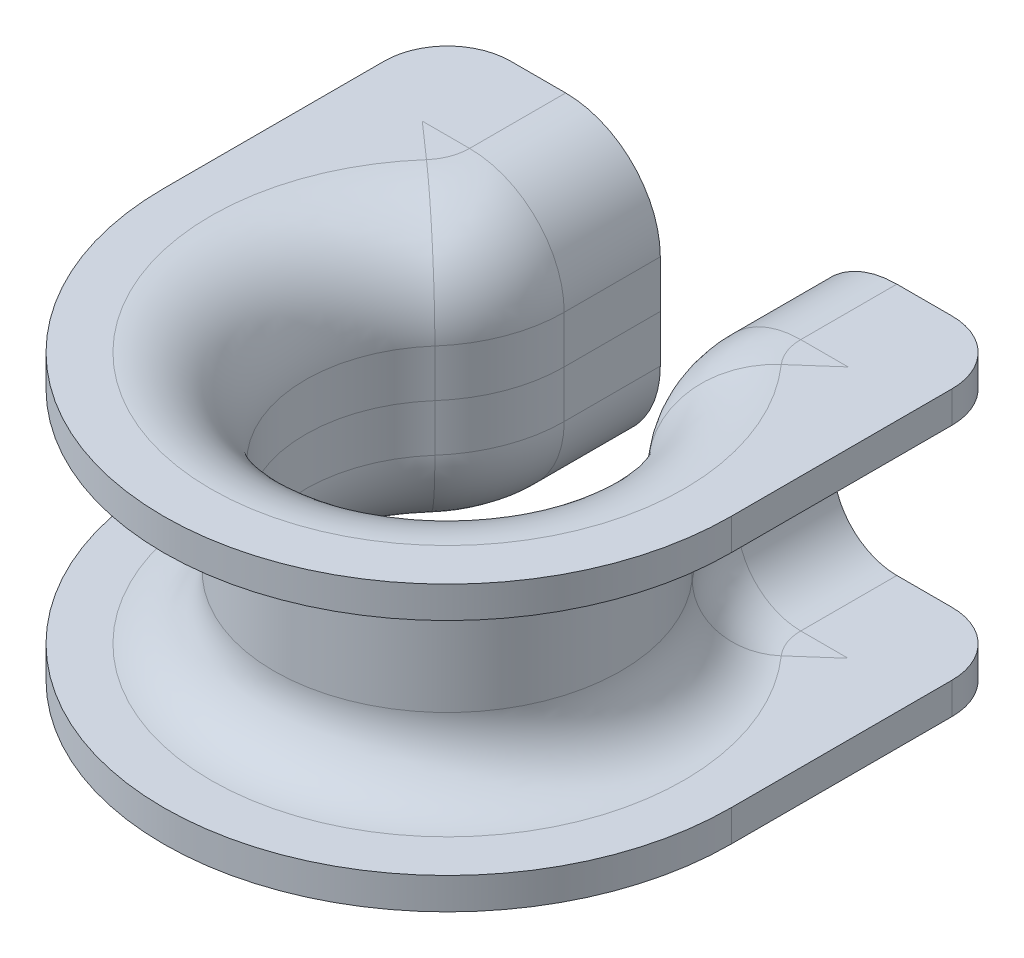
from build123d import *

# Parameters (mm, degrees)
BOSS_EXTRUDE1_REACH      = 43.243
BOSS_EXTRUDE1_END_RADIUS = 18
SKETCH4_W                = 4.5
SKETCH4_H                = 2
FILLET1_R                = 4


with BuildPart() as part:
    # Sweep1: sweep along a path in Sketch1
    with BuildLine(Plane(origin=(0, 0, 0), x_dir=(1, 0, 0), z_dir=(0, 1, 0))) as sweep1_path:
        Line((-4.5, 18), (-4.5, 11.9058809))
        ThreePointArc((-4.5, 11.9058809), (-5.08127088, 8.723900384), (-6.75, 5.95294045))
        ThreePointArc((-6.75, 5.95294045), (0, -9), (6.75, 5.95294045))
        ThreePointArc((6.75, 5.95294045), (5.08127088, 8.723900384), (4.5, 11.9058809))
        Line((4.5, 11.9058809), (4.5, 18))
    # Sketch3 → Sweep1 (sweep)
    with BuildSketch(Plane(origin=(0, 0, 0), x_dir=(0, 0, -1), z_dir=(1, 0, 0))):
        with BuildLine():
            Line((-18, 9), (-15, 9))
            ThreePointArc((-15, 9), (-10.757359313, 7.242640687), (-9, 3))
            Line((-9, 3), (-9, 0))
            Line((-9, 0), (-9, -3))
            ThreePointArc((-9, -3), (-10.757359313, -7.242640687), (-15, -9))
            Line((-15, -9), (-18, -9))
            Line((-18, -9), (-18, -7))
            Line((-18, -7), (-15, -7))
            ThreePointArc((-15, -7), (-12.171572875, -5.828427125), (-11, -3))
            Line((-11, -3), (-11, 3))
            ThreePointArc((-11, 3), (-12.171572875, 5.828427125), (-15, 7))
            Line((-15, 7), (-18, 7))
            Line((-18, 7), (-18, 9))
        make_face()
    sweep(path=sweep1_path.line)

    # Boss-Extrude1: up to this cylinder (the profile starts outside it)
    boss_extrude1_end = Plane(origin=(0, 0, 0), z_dir=(0, 1, 0)) * Cylinder(BOSS_EXTRUDE1_END_RADIUS, 139.486, mode=Mode.PRIVATE)
    # Sketch4 → Boss-Extrude1 (add, up to the surface)
    with BuildSketch(Plane(origin=(0, 0, -18), x_dir=(-1, 0, 0), z_dir=(0, 0, -1)), mode=Mode.PRIVATE) as boss_extrude1_sk1:
        with Locations((-15.75, 8)):
            Rectangle(SKETCH4_W, SKETCH4_H)
    boss_extrude1_tool1 = extrude(boss_extrude1_sk1.sketch, amount=-BOSS_EXTRUDE1_REACH, mode=Mode.PRIVATE) - boss_extrude1_end
    add(boss_extrude1_tool1.solids().sort_by_distance((15.75, 8, -18))[0])
    # Sketch4 → Boss-Extrude1 (add, up to the surface)
    with BuildSketch(Plane(origin=(0, 0, -18), x_dir=(-1, 0, 0), z_dir=(0, 0, -1)), mode=Mode.PRIVATE) as boss_extrude1_sk2:
        with Locations((15.75, 8)):
            Rectangle(SKETCH4_W, SKETCH4_H)
    boss_extrude1_tool2 = extrude(boss_extrude1_sk2.sketch, amount=-BOSS_EXTRUDE1_REACH, mode=Mode.PRIVATE) - boss_extrude1_end
    add(boss_extrude1_tool2.solids().sort_by_distance((-15.75, 8, -18))[0])
    # Sketch4 → Boss-Extrude1 (add, up to the surface)
    with BuildSketch(Plane(origin=(0, 0, -18), x_dir=(-1, 0, 0), z_dir=(0, 0, -1)), mode=Mode.PRIVATE) as boss_extrude1_sk3:
        with Locations((15.75, -8)):
            Rectangle(SKETCH4_W, SKETCH4_H)
    boss_extrude1_tool3 = extrude(boss_extrude1_sk3.sketch, amount=-BOSS_EXTRUDE1_REACH, mode=Mode.PRIVATE) - boss_extrude1_end
    add(boss_extrude1_tool3.solids().sort_by_distance((-15.75, -8, -18))[0])
    # Sketch4 → Boss-Extrude1 (add, up to the surface)
    with BuildSketch(Plane(origin=(0, 0, -18), x_dir=(-1, 0, 0), z_dir=(0, 0, -1)), mode=Mode.PRIVATE) as boss_extrude1_sk4:
        with Locations((-15.75, -8)):
            Rectangle(SKETCH4_W, SKETCH4_H)
    boss_extrude1_tool4 = extrude(boss_extrude1_sk4.sketch, amount=-BOSS_EXTRUDE1_REACH, mode=Mode.PRIVATE) - boss_extrude1_end
    add(boss_extrude1_tool4.solids().sort_by_distance((15.75, -8, -18))[0])

    # Fillet1
    fillet1_edges = [part.edges().sort_by_distance(p)[0] for p in [
        (18, -8, -18),
        (-18, -8, -18),
        (-18, 8, -18),
        (18, 8, -18),
    ]]
    fillet(fillet1_edges, radius=FILLET1_R)


solid = part.part
